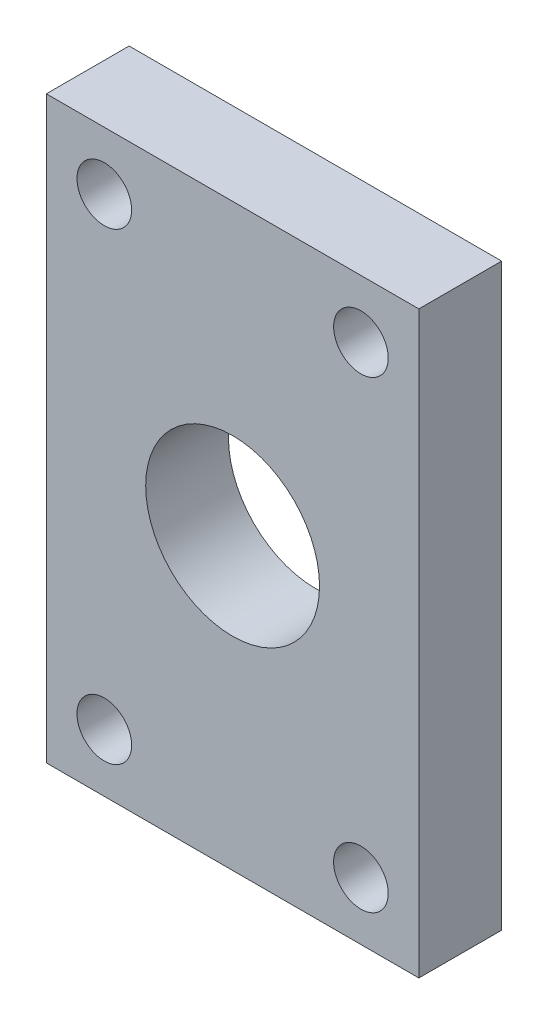
from build123d import *

# Parameters (mm, degrees)
SCHIZZO1_W                   = 45
SCHIZZO1_H                   = 70
ESTRUSIONE_ESTRUSIONE1_DEPTH = 10
SCHIZZO2_R                   = 10.5
SCHIZZO2_R_2                 = 3.3
TAGLIO_ESTRUSIONE1_DEPTH     = 10


with BuildPart() as part:
    # Schizzo1 → Estrusione-Estrusione1 (new body)
    with BuildSketch(Plane.XY):
        with Locations((22.5, 35)):
            Rectangle(SCHIZZO1_W, SCHIZZO1_H)
    extrude(amount=-ESTRUSIONE_ESTRUSIONE1_DEPTH)

    # Schizzo2 → Taglio-Estrusione1 (cut)
    with BuildSketch(Plane.XY):
        with Locations((22.5, 35)):
            Circle(SCHIZZO2_R)
        with Locations((38, 7)):
            Circle(SCHIZZO2_R_2)
        with Locations(Location((38, 63, 0), (0, 0, 180))):
            Circle(SCHIZZO2_R_2)
        with Locations(Location((7, 7, 0), (0, 0, 180))):
            Circle(SCHIZZO2_R_2)
        with Locations((7, 63)):
            Circle(SCHIZZO2_R_2)
    extrude(amount=-TAGLIO_ESTRUSIONE1_DEPTH, mode=Mode.SUBTRACT)


solid = part.part
